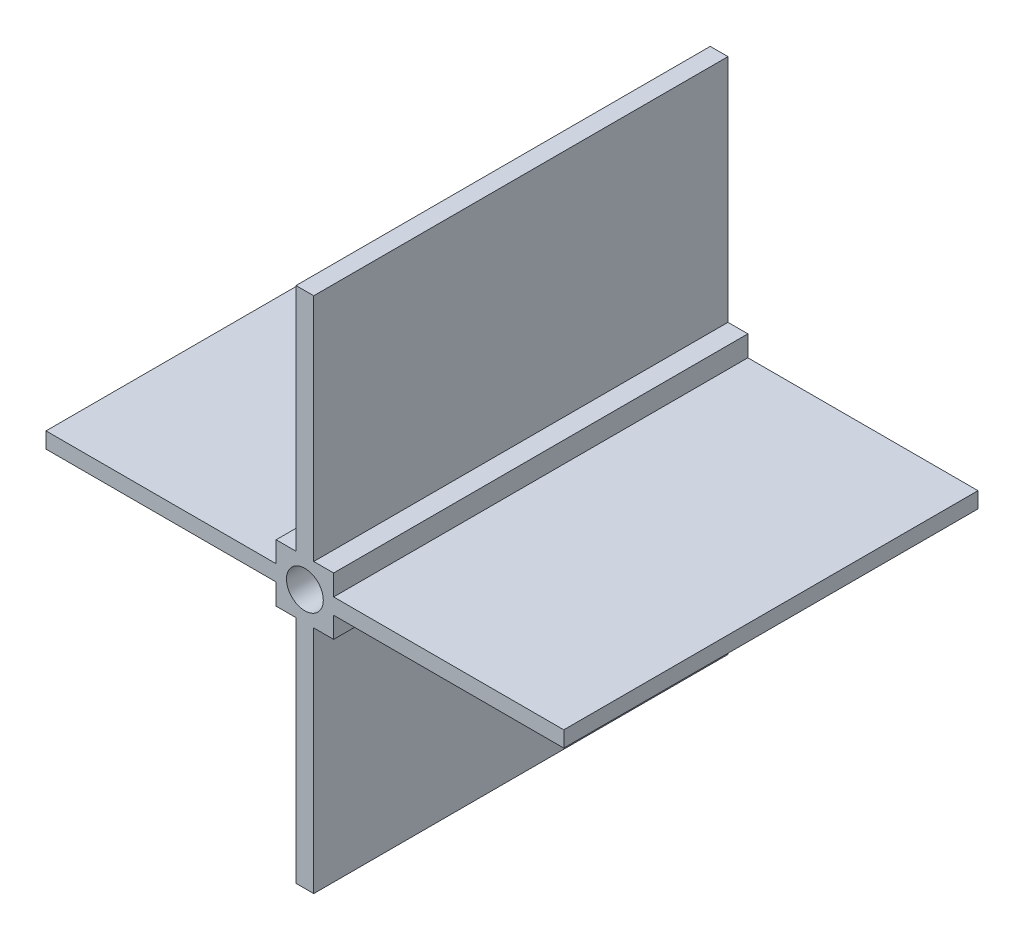
from build123d import *

# Parameters (mm, degrees)
BOSS_EXTRUDE1_DEPTH = 45.72
SKETCH2_R           = 2.032
CUT_EXTRUDE1_DEPTH  = 45.72


with BuildPart() as part:
    # Sketch1 → Boss-Extrude1 (new body)
    with BuildSketch(Plane.XY):
        Polygon((-3.175, 0.884089911), (-3.175, 3.175), (-0.979194969, 3.175), (-0.979194969, 28.575), (0.978019253, 28.575), (0.978019253, 3.175), (3.175, 3.175), (3.175, 0.884089911), (28.575, 0.884089911), (28.575, -0.86253999), (3.175, -0.86253999), (3.175, -3.175), (0.978019253, -3.175), (0.978019253, -28.575), (-0.979194969, -28.575), (-0.979194969, -3.175), (-3.175, -3.175), (-3.175, -0.86253999), (-28.575, -0.86253999), (-28.575, 0.884089911), align=None)
    extrude(amount=BOSS_EXTRUDE1_DEPTH)

    # Sketch2 → Cut-Extrude1 (cut)
    with BuildSketch(Plane.XY.offset(45.72)):
        Circle(SKETCH2_R)
    extrude(amount=-CUT_EXTRUDE1_DEPTH, mode=Mode.SUBTRACT)


solid = part.part
